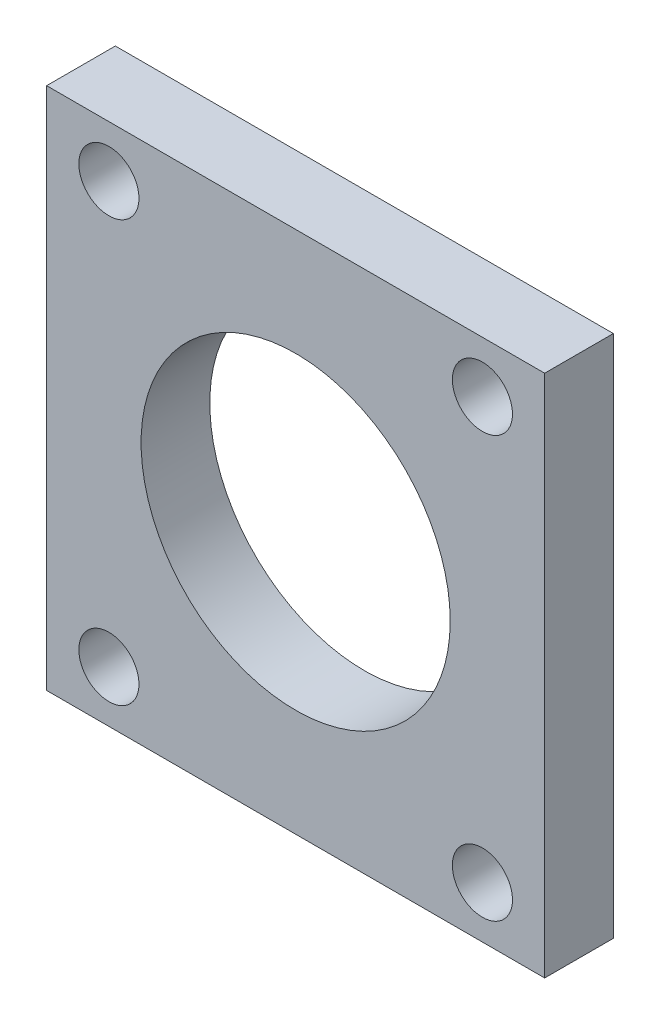
from build123d import *

# Parameters (mm, degrees)
SKETCH1_W           = 58
SKETCH1_H           = 61
SKETCH1_R           = 18
BOSS_EXTRUDE1_DEPTH = 8
SKETCH26_R          = 12.25
SKETCH26_R_2        = 3.500000003
SKETCH26_R_3        = 2.7
CUT_EXTRUDE25_DEPTH = 80


with BuildPart() as part:
    # Sketch1 → Boss-Extrude1 (new body)
    with BuildSketch(Plane.XY):
        with Locations((-375.83204095, -9.5)):
            Rectangle(SKETCH1_W, SKETCH1_H)
        with Locations((-375.83204095, -9.5)):
            Circle(SKETCH1_R, mode=Mode.SUBTRACT)
    extrude(amount=BOSS_EXTRUDE1_DEPTH)

    # Sketch26 → Cut-Extrude25 (cut)
    with BuildSketch(Plane(origin=(-392.722155748, 41.581437247, 68), x_dir=(-1, 0, 0), z_dir=(0, 0, 1))):
        with Locations((-16.890114798, 51.081437247)):
            Circle(SKETCH26_R)
        with Locations(Location((-38.640114797, 75.581437247, 0), (0, 0, 180))):
            Circle(SKETCH26_R_2)
        with Locations(Location((4.859885202, 75.581437247, 0), (0, 0, 180))):
            Circle(SKETCH26_R_2)
        with Locations(Location((-38.640114797, 26.581437247, 0), (0, 0, 180))):
            Circle(SKETCH26_R_2)
        with Locations(Location((4.859885202, 26.581437247, 0), (0, 0, 180))):
            Circle(SKETCH26_R_2)
        with Locations((-16.890114798, 16.121848563)):
            Circle(SKETCH26_R_3)
    extrude(amount=-CUT_EXTRUDE25_DEPTH, mode=Mode.SUBTRACT)


solid = part.part
